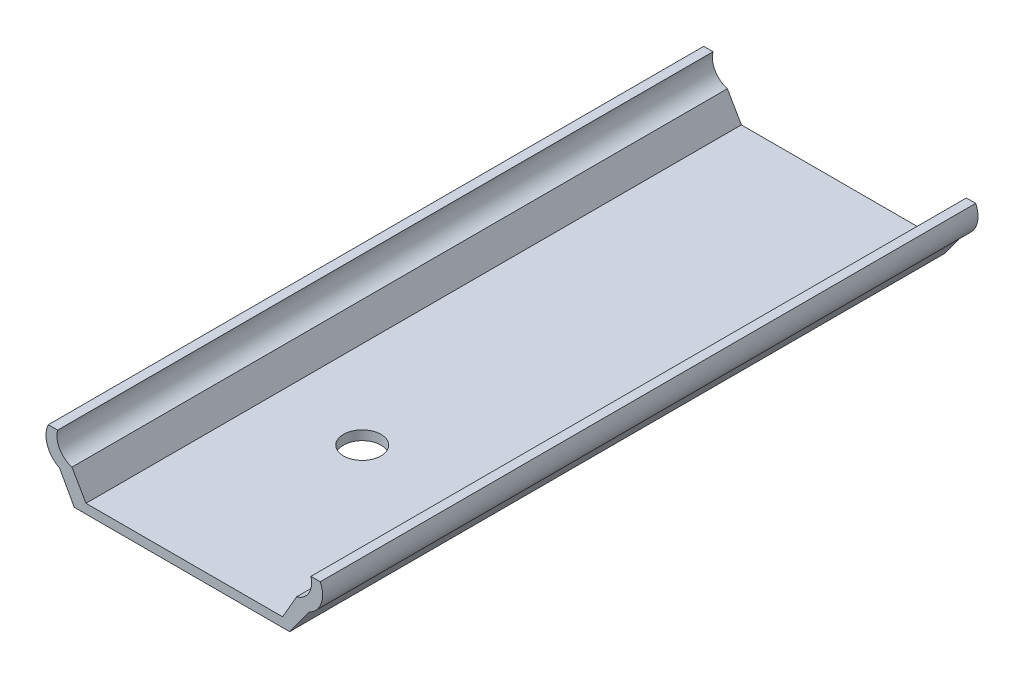
from build123d import *

# Parameters (mm, degrees)
BOSS_EXTRU_1_DEPTH = 70
SKETCH1_R          = 2
CUT_EXTRUDE1_DEPTH = 10


with BuildPart() as part:
    # Esquisse1 → Boss.-Extru.1 (new body)
    with BuildSketch(Plane.XY):
        with BuildLine():
            Line((-10.5, 0), (10.5, 0))
            Line((10.5, 0), (11.996134815, 2.600303947))
            ThreePointArc((11.996134815, 2.600303947), (13.310550199, 3.611999394), (13.524605519, 5.256808137))
            Line((13.524605519, 5.256808137), (14.524605519, 5.256808137))
            ThreePointArc((14.524605519, 5.256808137), (14.624387393, 3.298979885), (13.310550199, 1.844029812))
            Line((13.310550199, 1.844029812), (11.249883314, -1))
            Line((11.249883314, -1), (-11.750116686, -1))
            Line((-11.750116686, -1), (-13.310550199, 1.844029812))
            ThreePointArc((-13.310550199, 1.844029812), (-14.624387393, 3.298979885), (-14.524605519, 5.256808137))
            Line((-14.524605519, 5.256808137), (-13.524605519, 5.256808137))
            ThreePointArc((-13.524605519, 5.256808137), (-13.310550199, 3.611999394), (-11.996134815, 2.600303947))
            Line((-11.996134815, 2.600303947), (-10.5, 0))
        make_face()
    extrude(amount=BOSS_EXTRU_1_DEPTH)

    # Sketch1 → Cut-Extrude1 (cut)
    with BuildSketch(Plane.XZ.offset(1)):
        with Locations(Location((-1.130377356, 49.868372079, 0), (0, 0, 270))):
            Circle(SKETCH1_R)
    extrude(amount=-CUT_EXTRUDE1_DEPTH, mode=Mode.SUBTRACT)


solid = part.part
